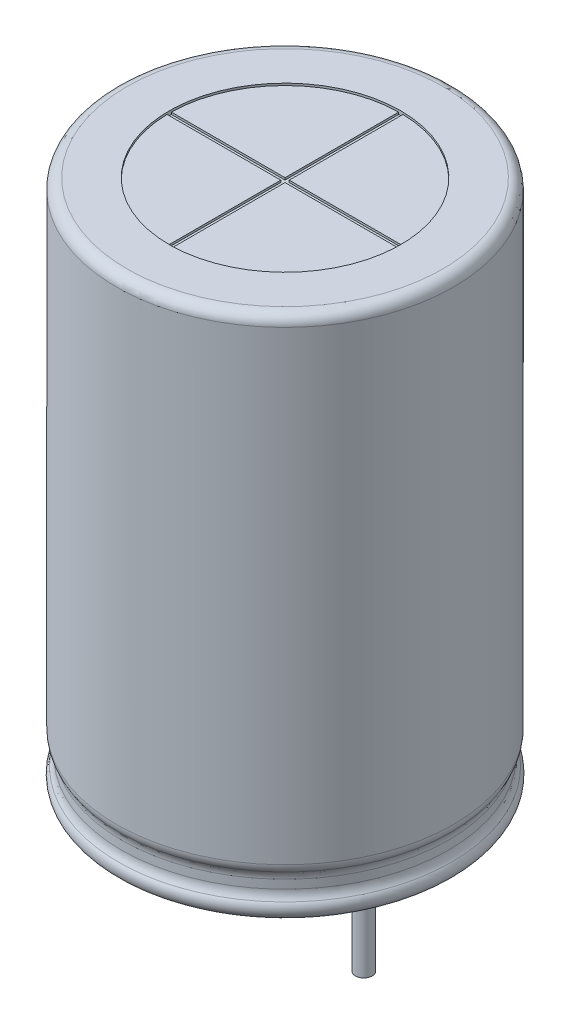
from build123d import *

# Parameters (mm, degrees)
SKETCH2_R             = 5.5
CUT_EXTRUDE1_DEPTH    = 0.1
CUT_EXTRUDE2_DEPTH    = 0.1
CORTAR_EXTRUIR1_START = -0.25
CROQUIS1_R            = 5.5
CORTAR_EXTRUIR1_DEPTH = 0.25
FILLET1_R             = 0.5
SKETCH4_W             = 0.4
SKETCH4_H             = 6


with BuildPart() as part:
    # Sketch1 → Revolve1 (revolve)
    with BuildSketch(Plane.XY):
        with BuildLine():
            Line((8, 25), (0, 25))
            Line((0, 25), (0, 0))
            Line((0, 0), (8, 0))
            ThreePointArc((8, 0), (8.092932458, 0.406232629), (7.928060317, 0.788957816))
            ThreePointArc((7.928060317, 0.788957816), (7.803725589, 0.995469347), (7.760416667, 1.232599004))
            Line((7.760416667, 1.232599004), (7.760416667, 1.642400996))
            ThreePointArc((7.760416667, 1.642400996), (7.791064683, 1.842850794), (7.880208333, 2.024984899))
            ThreePointArc((7.880208333, 2.024984899), (7.969351983, 2.207119004), (8, 2.407568802))
            Line((8, 2.407568802), (8, 25))
        make_face()
    revolve(axis=Axis((0, 25, 0), (0, -1, 0)))

    # Sketch2 → Cut-Extrude1 (cut)
    with BuildSketch(Plane(origin=(0, 25, 0), x_dir=(-1, 0, 0), z_dir=(0, 1, 0))):
        with Locations(Location((0, 0, 0), (0, 0, 270))):
            Circle(SKETCH2_R)
    extrude(amount=-CUT_EXTRUDE1_DEPTH, mode=Mode.SUBTRACT)

    # Sketch3 → Cut-Extrude2 (cut)
    with BuildSketch(Plane(origin=(0, 24.9, 0), x_dir=(-1, 0, 0), z_dir=(0, 1, 0))):
        with BuildLine():
            Line((-5.499090834, -0.1), (-0.1, -0.1))
            Line((-0.1, -0.1), (-0.1, -5.499090834))
            ThreePointArc((-0.1, -5.499090834), (-0.050002066, -5.499772704), (0, -5.5))
            ThreePointArc((0, -5.5), (0.050002066, -5.499772704), (0.1, -5.499090834))
            Line((0.1, -5.499090834), (0.1, -0.1))
            Line((0.1, -0.1), (5.499090834, -0.1))
            ThreePointArc((5.499090834, -0.1), (5.499772704, -0.050002066), (5.5, 0))
            ThreePointArc((5.5, 0), (5.499772704, 0.050002066), (5.499090834, 0.1))
            Line((5.499090834, 0.1), (0.1, 0.1))
            Line((0.1, 0.1), (0.1, 5.499090834))
            ThreePointArc((0.1, 5.499090834), (0.050002066, 5.499772704), (0, 5.5))
            ThreePointArc((0, 5.5), (-0.050002066, 5.499772704), (-0.1, 5.499090834))
            Line((-0.1, 5.499090834), (-0.1, 0.1))
            Line((-0.1, 0.1), (-5.499090834, 0.1))
            ThreePointArc((-5.499090834, 0.1), (-5.499772704, 0.050002066), (-5.5, 0))
            ThreePointArc((-5.5, 0), (-5.499772704, -0.050002066), (-5.499090834, -0.1))
        make_face()
    extrude(amount=-CUT_EXTRUDE2_DEPTH, mode=Mode.SUBTRACT)

    # Croquis1 → Cortar-Extruir1 (cut)
    with BuildSketch(Plane.XZ.offset(CORTAR_EXTRUIR1_START)):
        with Locations(Location((0, 0, 0), (0, 0, 88.95820115))):
            Circle(CROQUIS1_R)
    extrude(amount=CORTAR_EXTRUIR1_DEPTH, mode=Mode.SUBTRACT)

    # Fillet1
    fillet1_edges = [part.edges().sort_by_distance(p)[0] for p in [
        (-8, 25, 0),
        (-8, 0, 0),
    ]]
    fillet(fillet1_edges, radius=FILLET1_R)

    # Sketch4 → Revolución1 (revolve)
    with BuildSketch(Plane(origin=(0, 0, 0), x_dir=(-1, 0, 0), z_dir=(0, 0, -1)), mode=Mode.PRIVATE) as revoluci_n1_sk:
        with Locations((-3.941657387, -2.75)):
            Rectangle(SKETCH4_W, SKETCH4_H)
    revoluci_n1 = revolve(revoluci_n1_sk.sketch.rotate(Axis((3.741657387, -5.75, 0), (0, 1, 0)), 90), axis=Axis((3.741657387, -5.75, 0), (0, 1, 0)))

    # Simetría1: Revolución1 across plane
    add(revoluci_n1.mirror(Plane(origin=(0, 0, 0), x_dir=(0, 0, 1), z_dir=(1, 0, 0))))


solid = part.part
